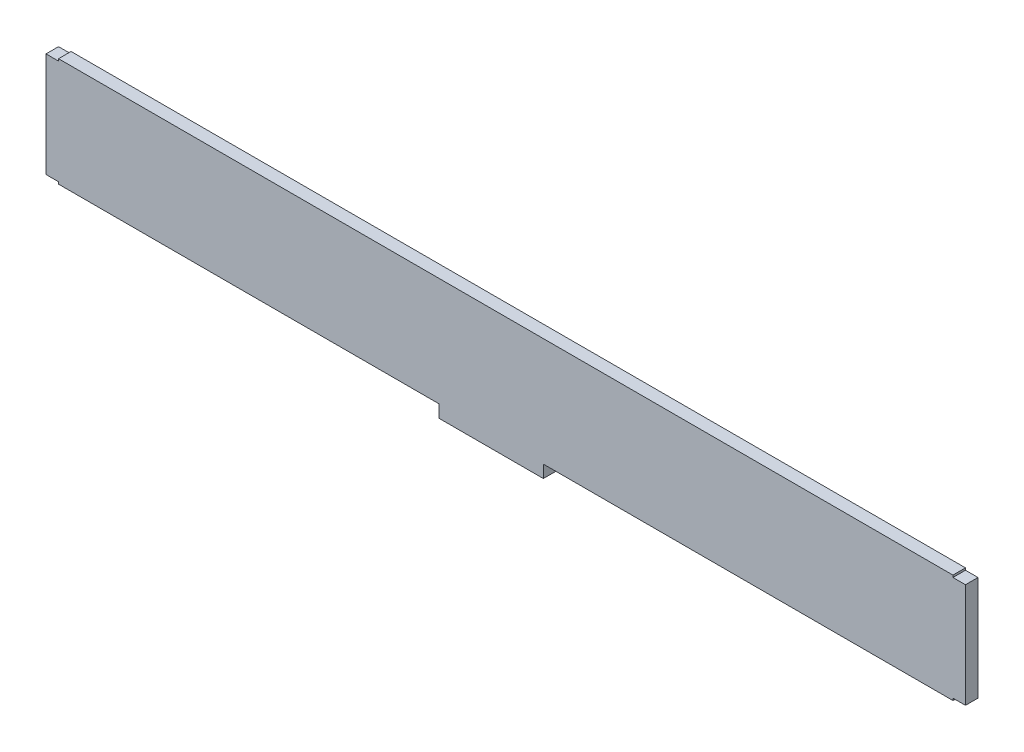
from build123d import *

# Parameters (mm, degrees)
BOSS_EXTRUDE1_DEPTH = 6


with BuildPart() as part:
    # Sketch1 → Boss-Extrude1 (new body)
    with BuildSketch(Plane.XY):
        Polygon((0, 0), (428, 0), (428, -1), (434, -1), (434, -51), (428, -51), (428, -52), (232, -52), (232, -58), (182, -58), (182, -52), (0, -52), (0, -51), (-6, -51), (-6, -1), (0, -1), align=None)
    extrude(amount=BOSS_EXTRUDE1_DEPTH)


solid = part.part
